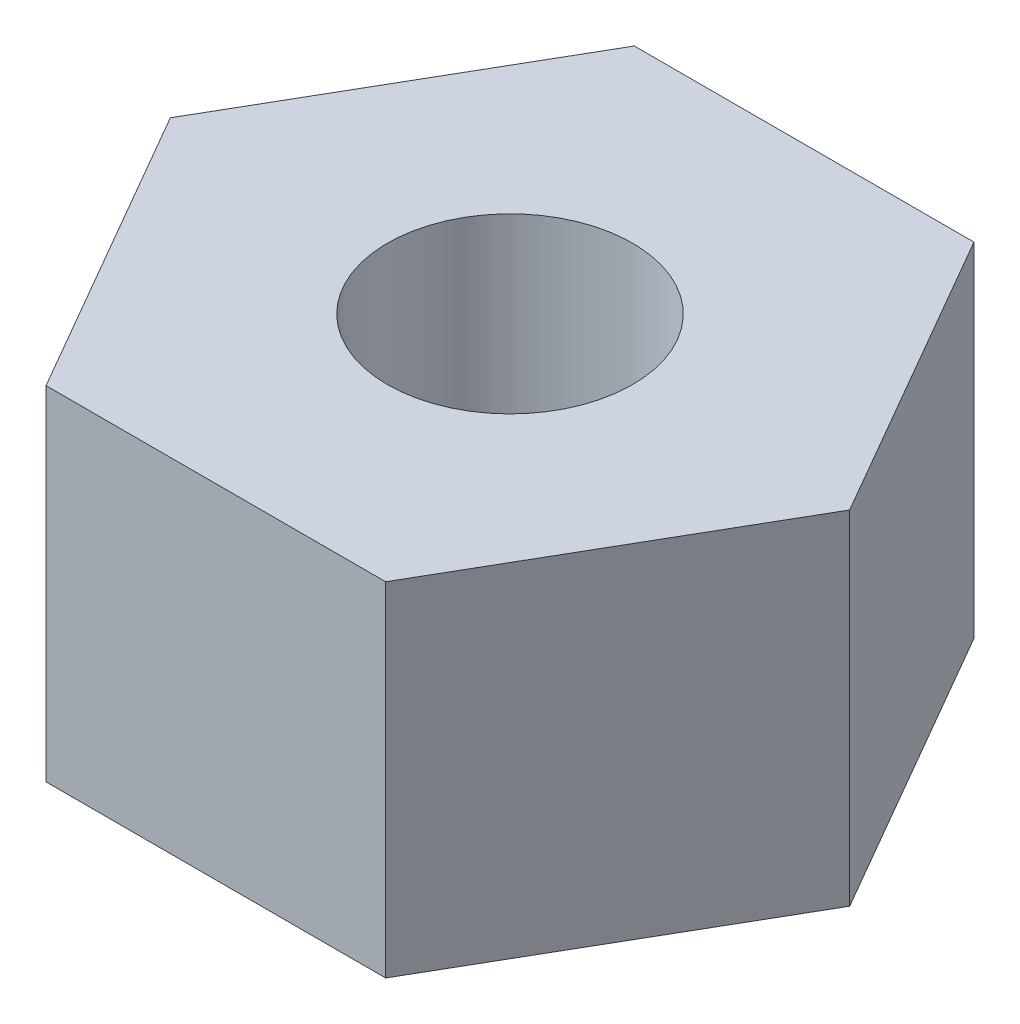
from build123d import *

# Parameters (mm, degrees)
SKETCH1_R           = 1.25
BOSS_EXTRUDE1_DEPTH = 3.5


with BuildPart() as part:
    # Sketch1 → Boss-Extrude1 (new body)
    with BuildSketch(Plane(origin=(0, 0, 0), x_dir=(1, 0, 0), z_dir=(0, 1, 0))):
        Polygon((3.464101615, 0), (1.732050808, 3), (-1.732050808, 3), (-3.464101615, 0), (-1.732050808, -3), (1.732050808, -3), align=None)
        with Locations(Location((0, 0, 0), (0, 0, 270))):
            Circle(SKETCH1_R, mode=Mode.SUBTRACT)
    extrude(amount=BOSS_EXTRUDE1_DEPTH)


solid = part.part
